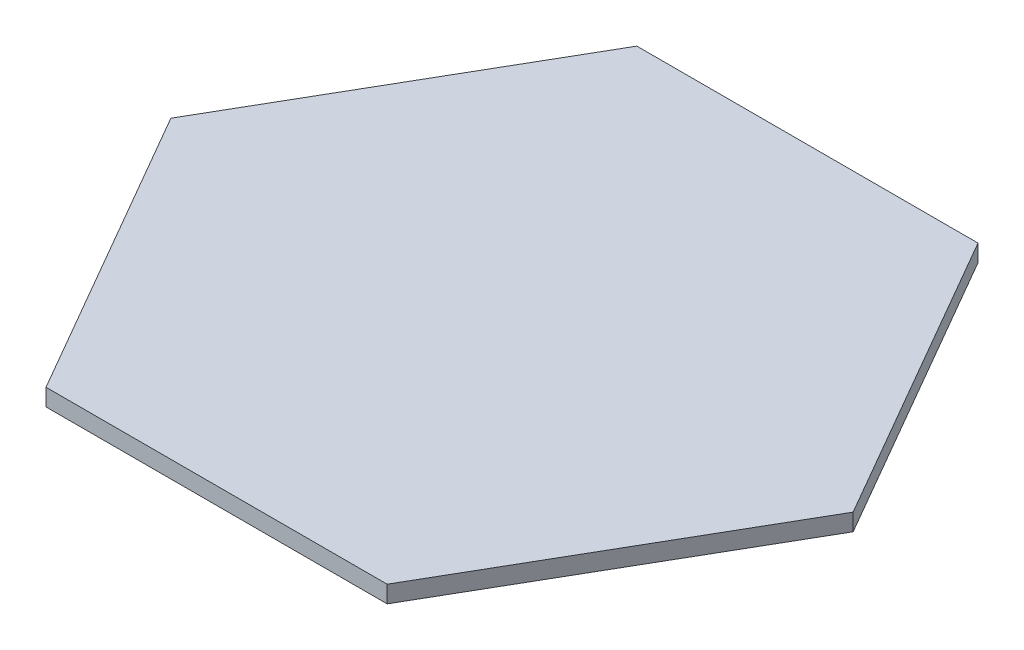
from build123d import *

# Parameters (mm, degrees)
EXTRUDE_1_DEPTH = 1


with BuildPart() as part:
    # 草圖1 → 填料-伸長1 (new body)
    with BuildSketch(Plane(origin=(0, 0, 0), x_dir=(1, 0, 0), z_dir=(0, 1, 0))):
        Polygon((-20, 0), (-10, -17.320508076), (10, -17.320508076), (20, 0), (10, 17.320508076), (-10, 17.320508076), align=None)
    extrude(amount=EXTRUDE_1_DEPTH)


solid = part.part
